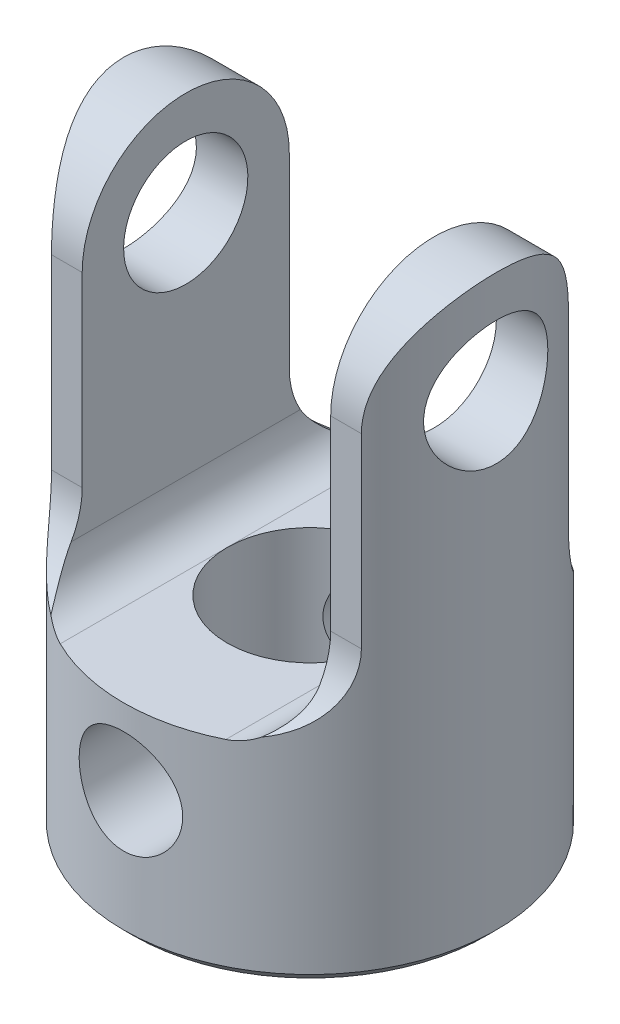
from build123d import *

# Parameters (mm, degrees)
SKETCH1_R               = 4.5
SKETCH1_R_2             = 2
BOSS_EXTRUDE1_DEPTH     = 14
CUT_EXTRUDE1_DEPTH      = 16.378556499
CUT_EXTRUDE1_DEPTH_BACK = 16.378556499
SKETCH2_R               = 1.25
CUT_EXTRUDE2_DEPTH      = 16.378556652
CUT_EXTRUDE2_DEPTH_BACK = 16.378556652
SKETCH3_R               = 1.5
CHAMFER1_SIZE           = 0.25


with BuildPart() as part:
    # Sketch1 → Boss-Extrude1 (new body)
    with BuildSketch(Plane(origin=(0, 0, 0), x_dir=(1, 0, 0), z_dir=(0, 1, 0))):
        with Locations(Location((0, 0, 0), (0, 0, 270))):
            Circle(SKETCH1_R)
        with Locations(Location((0, 0, 0), (0, 0, 270))):
            Circle(SKETCH1_R_2, mode=Mode.SUBTRACT)
    extrude(amount=BOSS_EXTRUDE1_DEPTH)

    # Sketch2 → Cut-Extrude1 (cut, two sides: drawn at the far end of the back side and taken through both)
    with BuildSketch(Plane.XY.offset(-CUT_EXTRUDE1_DEPTH_BACK)):
        with Locations((0, 3.15)):
            Circle(SKETCH2_R)
        with BuildLine():
            Line((-3, 14), (3, 14))
            Line((3, 14), (3, 6))
            ThreePointArc((3, 6), (2.707106781, 5.292893219), (2, 5))
            Line((2, 5), (-2, 5))
            ThreePointArc((-2, 5), (-2.707106781, 5.292893219), (-3, 6))
            Line((-3, 6), (-3, 14))
        make_face()
    extrude(amount=CUT_EXTRUDE1_DEPTH + CUT_EXTRUDE1_DEPTH_BACK, mode=Mode.SUBTRACT)

    # Sketch3 → Cut-Extrude2 (cut, two sides: drawn at the far end of the back side and taken through both)
    with BuildSketch(Plane(origin=(0, 0, 0), x_dir=(0, 0, -1), z_dir=(1, 0, 0)).offset(-CUT_EXTRUDE2_DEPTH_BACK)):
        with Locations((0, 11.5)):
            Circle(SKETCH3_R)
        with BuildLine():
            Line((2.5, 11.5), (2.5, 7))
            ThreePointArc((2.5, 7), (3.085786438, 5.585786438), (4.5, 5))
            Line((4.5, 5), (4.5, 15))
            Line((4.5, 15), (-4.5, 15))
            Line((-4.5, 15), (-4.5, 5))
            ThreePointArc((-4.5, 5), (-3.085786438, 5.585786438), (-2.5, 7))
            Line((-2.5, 7), (-2.5, 11.5))
            ThreePointArc((-2.5, 11.5), (0, 14), (2.5, 11.5))
        make_face()
    extrude(amount=CUT_EXTRUDE2_DEPTH + CUT_EXTRUDE2_DEPTH_BACK, mode=Mode.SUBTRACT)

    # Chamfer1
    chamfer1_edges = [part.edges().sort_by_distance(p)[0] for p in [
        (0, 0, -4.5),
    ]]
    chamfer(chamfer1_edges, length=CHAMFER1_SIZE)


solid = part.part
